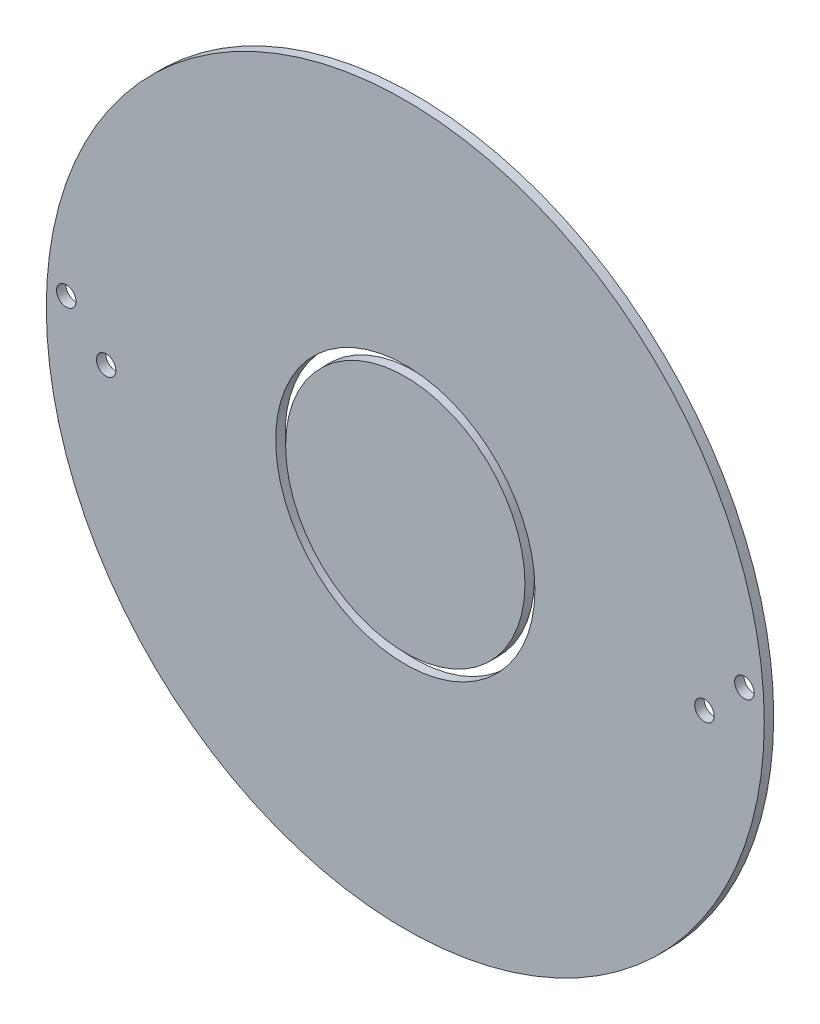
from build123d import *

# Parameters (mm, degrees)
SKETCH1_R          = 57.15
EXTRUDE1_DEPTH     = 1.5
SKETCH2_R          = 1.55
CUT_EXTRUDE1_DEPTH = 81.836223316
SKETCH3_R          = 20.6375
SKETCH3_R_2        = 19.05
CUT_EXTRUDE2_DEPTH = 81.836223316


with BuildPart() as part:
    # Sketch1 → Extrude1 (new body)
    with BuildSketch(Plane.XY):
        Circle(SKETCH1_R)
    extrude(amount=EXTRUDE1_DEPTH)

    # Sketch2 → Cut-Extrude1 (cut, through all)
    with BuildSketch(Plane.XY.offset(1.5)):
        with Locations((-53.975, 3.175)):
            Circle(SKETCH2_R)
        with Locations((-47.625, -3.175)):
            Circle(SKETCH2_R)
        with Locations((53.975, 3.175)):
            Circle(SKETCH2_R)
        with Locations((47.625, -3.175)):
            Circle(SKETCH2_R)
    extrude(amount=-CUT_EXTRUDE1_DEPTH, mode=Mode.SUBTRACT)

    # Sketch3 → Cut-Extrude2 (cut, through all)
    with BuildSketch(Plane.XY.offset(1.5)):
        Circle(SKETCH3_R)
        Circle(SKETCH3_R_2, mode=Mode.SUBTRACT)
    extrude(amount=-CUT_EXTRUDE2_DEPTH, mode=Mode.SUBTRACT)


with BuildPart() as cut_extrude2_piece_1:
    # of the separate pieces the step leaves, piece 1, a body of its own (cut_extrude2_pieces)
    add(part.part.solids().sort_by_distance((57.15, 0, 0))[0])


with BuildPart() as cut_extrude2_piece_2:
    # of the separate pieces the step leaves, piece 2, a body of its own (cut_extrude2_pieces)
    add(part.part.solids().sort_by_distance((19.05, 0, 0))[0])


solid = Compound([cut_extrude2_piece_1.part, cut_extrude2_piece_2.part])
